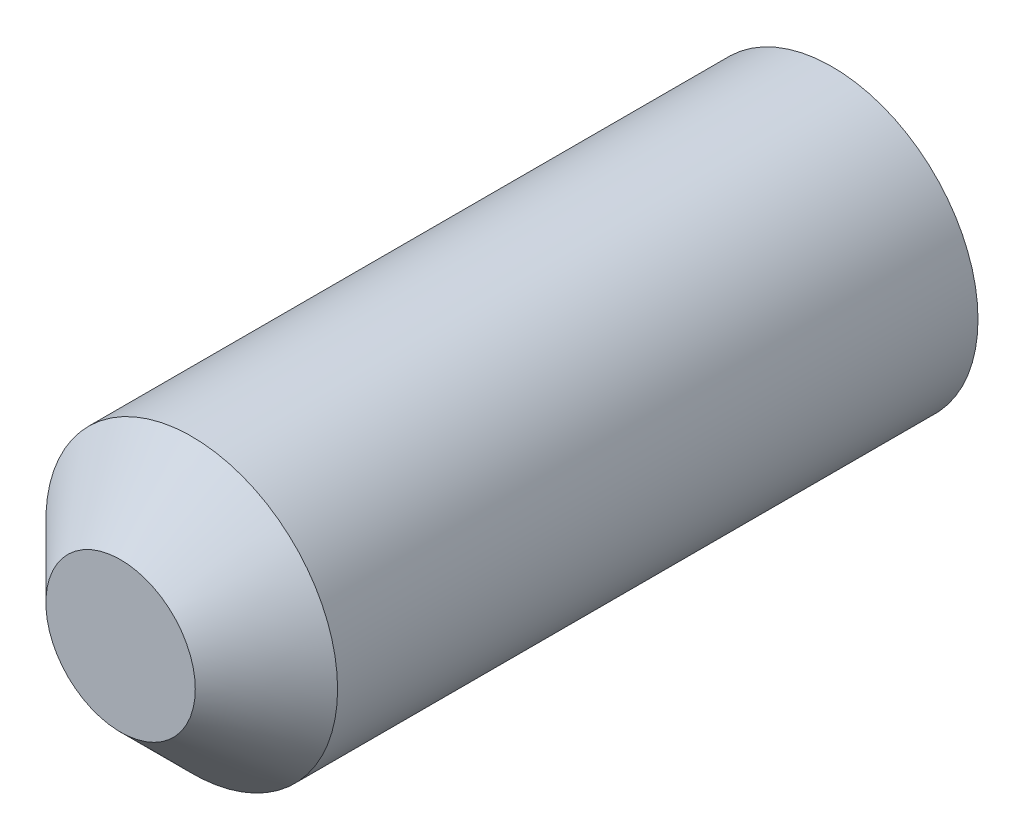
from build123d import *

# Parameters (mm, degrees)
SCHIZZO1_R                   = 2.05
ESTRUSIONE_ESTRUSIONE1_DEPTH = 10
SMUSSO1_SIZE                 = 1


with BuildPart() as part:
    # Schizzo1 → Estrusione-Estrusione1 (new body)
    with BuildSketch(Plane.XY):
        Circle(SCHIZZO1_R)
    extrude(amount=ESTRUSIONE_ESTRUSIONE1_DEPTH)

    # Smusso1
    smusso1_edges = [part.edges().sort_by_distance(p)[0] for p in [
        (-2.05, 0, 10),
    ]]
    chamfer(smusso1_edges, length=SMUSSO1_SIZE)


solid = part.part
